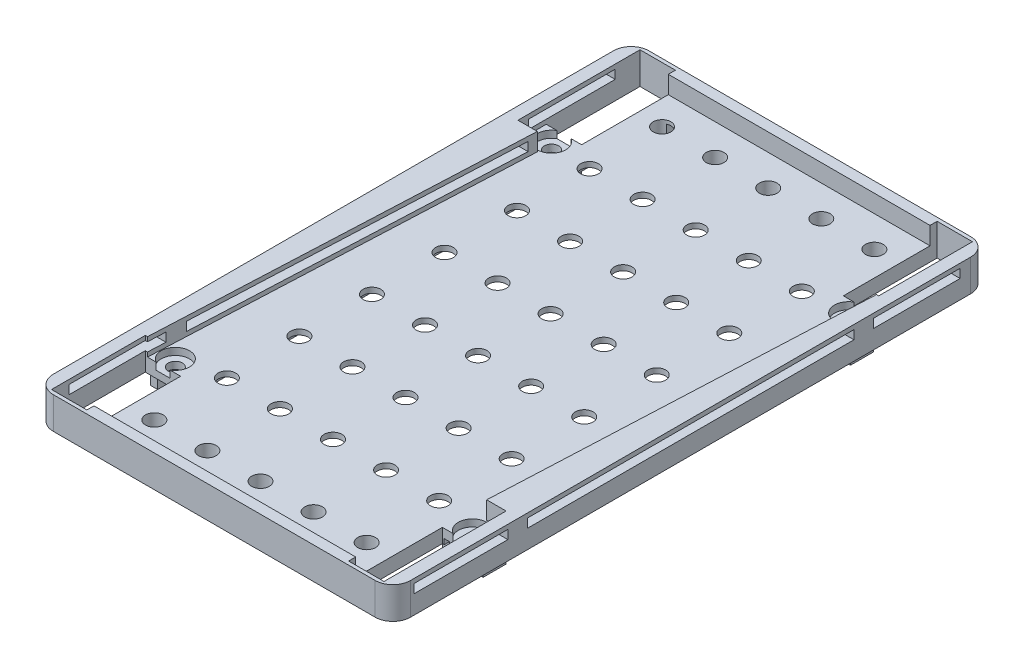
from build123d import *

# Parameters (mm, degrees)
SKETCH1_W                 = 100.974473103
SKETCH1_H                 = 168.325232528
BOSS_EXTRUDE1_DEPTH       = 5
SKETCH2_W                 = 100.974473103
SKETCH2_H                 = 168.325232528
BOSS_EXTRUDE2_DEPTH       = 4
SKETCH4_W                 = 2
SKETCH4_H                 = 6.5
BOSS_EXTRUDE3_DEPTH       = 4
SKETCH4_5_W               = 2
SKETCH4_5_H               = 25
SKETCH4_5_W_2             = 6
CUT_EXTRUDE3_DEPTH        = 124
SKETCH4_6_R               = 2
CUT_EXTRUDE4_DEPTH        = 124
CUT_EXTRUDE5_START        = -2
SKETCH6_R                 = 4
CUT_EXTRUDE5_DEPTH        = 21
SKETCH7_W                 = 10
SKETCH7_H                 = 1.5
CUT_EXTRUDE6_DEPTH        = 19
MIRROR3_COPY_1_SKETCH_W   = 2
MIRROR3_COPY_1_SKETCH_H   = 6.5
MIRROR3_COPY_1_DEPTH      = 4
MIRROR3_COPY_2_SKETCH_W   = 2
MIRROR3_COPY_2_SKETCH_H   = 25
MIRROR3_COPY_2_SKETCH_W_2 = 6
MIRROR3_COPY_2_DEPTH      = 124
MIRROR3_COPY_3_SKETCH_R   = 2
MIRROR3_COPY_3_DEPTH      = 124
MIRROR3_START             = -2
MIRROR3_COPY_4_SKETCH_R   = 4
MIRROR3_COPY_4_DEPTH      = 21
MIRROR3_COPY_5_SKETCH_W   = 10
MIRROR3_COPY_5_SKETCH_H   = 1.5
MIRROR3_COPY_5_DEPTH      = 19
SKETCH10_W                = 2
SKETCH10_H                = 6.5
BOSS_EXTRUDE4_DEPTH       = 4
MIRROR5_COPY_1_SKETCH_W   = 2
MIRROR5_COPY_1_SKETCH_H   = 6.5
MIRROR5_COPY_1_DEPTH      = 4
SKETCH8_W                 = 68.974473103
SKETCH8_H                 = 127.325232528
CUT_EXTRUDE7_DEPTH        = 2.5
FILLET1_R                 = 5
FILLET2_R                 = 5
FILLET3_R                 = 5
FILLET4_R                 = 5
SKETCH12_W                = 50.974473103
SKETCH12_H                = 2
BOSS_EXTRUDE6_DEPTH       = 17.5
SKETCH13_W                = 50.974473103
SKETCH13_H                = 1.5
BOSS_EXTRUDE7_DEPTH       = 20
SKETCH14_W                = 5.504592277
SKETCH14_H                = 8
CUT_EXTRUDE11_DEPTH       = 5
SKETCH15_W                = 5.504592276
SKETCH15_H                = 8
CUT_EXTRUDE13_DEPTH       = 5
SKETCH16_W                = 1.5
SKETCH16_H                = 9.191255783
SKETCH16_H_2              = 8.623656915
SKETCH16_H_3              = 11.145550433
SKETCH16_H_4              = 13.525087137
CUT_EXTRUDE15_DEPTH       = 1.5
SKETCH17_W                = 3
SKETCH17_H                = 20.5
CUT_EXTRUDE16_DEPTH       = 3
SKETCH18_W                = 2.5
SKETCH18_H                = 20.682541109
SKETCH18_H_2              = 20
SKETCH18_W_2              = 14.974473103
CUT_EXTRUDE18_DEPTH       = 19
BOSS_EXTRUDE8_START       = -45.974473
BOSS_EXTRUDE8_DEPTH       = 45.974473
SKETCH20_W                = 14.974473103
SKETCH20_H                = 5.765862106
CUT_EXTRUDE19_DEPTH       = 19
SKETCH21_W                = 92.325232528
SKETCH21_H                = 2.5
CUT_EXTRUDE21_DEPTH       = 151
SKETCH22_R                = 2.5
CUT_EXTRUDE22_DEPTH       = 151
LPATTERN1_COUNT           = 8
LPATTERN1_PITCH           = 20.5
BOSS_EXTRUDE9_DEPTH       = 5
BOSS_EXTRUDE10_DEPTH      = 6.5
BOSS_EXTRUDE11_DEPTH      = 6.5
SKETCH28_W                = 26.5
SKETCH28_H                = 2.5
SKETCH28_W_2              = 24.5
CUT_EXTRUDE23_DEPTH       = 124
SKETCH29_W                = 88.620615797
SKETCH29_H                = 24.04223464
CUT_EXTRUDE24_DEPTH       = 60


with BuildPart() as part:
    # Sketch1 → Boss-Extrude1 (new body)
    with BuildSketch(Plane(origin=(0, 0, 0), x_dir=(1, 0, 0), z_dir=(0, 1, 0))):
        with Locations((1.308903663, 1.25)):
            Rectangle(SKETCH1_W, SKETCH1_H)
        Polygon((-38.701208987, 82.412616264), (48.796140214, 82.412616264), (41.319016312, -79.912616264), (-46.178332889, -79.912616264), align=None, mode=Mode.SUBTRACT)
    extrude(amount=BOSS_EXTRUDE1_DEPTH)

    # Sketch2 → Boss-Extrude2 (add)
    with BuildSketch(Plane.XZ):
        with Locations((1.308903663, -1.25)):
            Rectangle(SKETCH2_W, SKETCH2_H)
    extrude(amount=BOSS_EXTRUDE2_DEPTH)

    # Sketch4 → Boss-Extrude3 (add)
    with BuildSketch(Plane.XZ.offset(4)):
        with Locations((47.296140214, -53.162616264)):
            Rectangle(SKETCH4_W, SKETCH4_H)
    boss_extrude3 = extrude(amount=BOSS_EXTRUDE3_DEPTH)

    # Sketch4<5> → Cut-Extrude3 (cut)
    with BuildSketch(Plane.XZ.offset(4)):
        with Locations((47.296140214, -70.412616264)):
            Rectangle(SKETCH4_5_W, SKETCH4_5_H)
        with Locations((43.296140214, -70.412616264)):
            Rectangle(SKETCH4_5_W_2, SKETCH4_5_H)
        with Locations((39.296140214, -70.412616264)):
            Rectangle(SKETCH4_5_W, SKETCH4_5_H)
    cut_extrude3 = extrude(amount=-CUT_EXTRUDE3_DEPTH, mode=Mode.SUBTRACT)

    # Sketch4<6> → Cut-Extrude4 (cut)
    with BuildSketch(Plane.XZ.offset(4)):
        with Locations(Location((43.296140214, -54.412616264, 0), (0, 0, 270))):
            Circle(SKETCH4_6_R)
    cut_extrude4 = extrude(amount=-CUT_EXTRUDE4_DEPTH, mode=Mode.SUBTRACT)

    # Sketch6 → Cut-Extrude5 (cut)
    with BuildSketch(Plane(origin=(0, 0, 0), x_dir=(1, 0, 0), z_dir=(0, 1, 0)).offset(CUT_EXTRUDE5_START)):
        with Locations((43.296140214, 54.412616264)):
            Circle(SKETCH6_R)
    cut_extrude5 = extrude(amount=CUT_EXTRUDE5_DEPTH, mode=Mode.SUBTRACT)

    # Sketch7 → Cut-Extrude6 (cut)
    with BuildSketch(Plane.XZ.offset(4)):
        with Locations((43.296140214, -83.662616264)):
            Rectangle(SKETCH7_W, SKETCH7_H)
    cut_extrude6 = extrude(amount=-CUT_EXTRUDE6_DEPTH, mode=Mode.SUBTRACT)

    # Mirror2: Boss-Extrude3, Cut-Extrude3, Cut-Extrude4, Cut-Extrude5, Cut-Extrude6 across plane
    add(boss_extrude3.mirror(Plane(origin=(0, 0, -1.25), x_dir=(1, 0, 0), z_dir=(0, 0, -1))))
    add(cut_extrude3.mirror(Plane(origin=(0, 0, -1.25), x_dir=(1, 0, 0), z_dir=(0, 0, -1))), mode=Mode.SUBTRACT)
    add(cut_extrude4.mirror(Plane(origin=(0, 0, -1.25), x_dir=(1, 0, 0), z_dir=(0, 0, -1))), mode=Mode.SUBTRACT)
    add(cut_extrude5.mirror(Plane(origin=(0, 0, -1.25), x_dir=(1, 0, 0), z_dir=(0, 0, -1))), mode=Mode.SUBTRACT)
    add(cut_extrude6.mirror(Plane(origin=(0, 0, -1.25), x_dir=(1, 0, 0), z_dir=(0, 0, -1))), mode=Mode.SUBTRACT)

    # Mirror3: Boss-Extrude3, Cut-Extrude3, Cut-Extrude4, Cut-Extrude5, Cut-Extrude6 across plane
    add(boss_extrude3.mirror(Plane.ZY.offset(-1.308903663)))
    add(cut_extrude3.mirror(Plane.ZY.offset(-1.308903663)), mode=Mode.SUBTRACT)
    add(cut_extrude4.mirror(Plane.ZY.offset(-1.308903663)), mode=Mode.SUBTRACT)
    add(cut_extrude5.mirror(Plane.ZY.offset(-1.308903663)), mode=Mode.SUBTRACT)
    add(cut_extrude6.mirror(Plane.ZY.offset(-1.308903663)), mode=Mode.SUBTRACT)

    # Mirror3 copy 1 sketch → Mirror3 copy 1 (add)
    with BuildSketch(Plane(origin=(2.617807325, -4, -2.5), x_dir=(-1, 0, 0), z_dir=(0, -1, 0))):
        with Locations((47.296140214, -53.162616264)):
            Rectangle(MIRROR3_COPY_1_SKETCH_W, MIRROR3_COPY_1_SKETCH_H)
    extrude(amount=MIRROR3_COPY_1_DEPTH)

    # Mirror3 copy 2 sketch → Mirror3 copy 2 (cut)
    with BuildSketch(Plane(origin=(2.617807325, -4, -2.5), x_dir=(-1, 0, 0), z_dir=(0, -1, 0))):
        with Locations((47.296140214, -70.412616264)):
            Rectangle(MIRROR3_COPY_2_SKETCH_W, MIRROR3_COPY_2_SKETCH_H)
        with Locations((43.296140214, -70.412616264)):
            Rectangle(MIRROR3_COPY_2_SKETCH_W_2, MIRROR3_COPY_2_SKETCH_H)
        with Locations((39.296140214, -70.412616264)):
            Rectangle(MIRROR3_COPY_2_SKETCH_W, MIRROR3_COPY_2_SKETCH_H)
    extrude(amount=-MIRROR3_COPY_2_DEPTH, mode=Mode.SUBTRACT)

    # Mirror3 copy 3 sketch → Mirror3 copy 3 (cut)
    with BuildSketch(Plane(origin=(2.617807325, -4, -2.5), x_dir=(-1, 0, 0), z_dir=(0, -1, 0))):
        with Locations(Location((43.296140214, -54.412616264, 0), (0, 0, 270))):
            Circle(MIRROR3_COPY_3_SKETCH_R)
    extrude(amount=-MIRROR3_COPY_3_DEPTH, mode=Mode.SUBTRACT)

    # Mirror3 copy 4 sketch → Mirror3 copy 4 (cut)
    with BuildSketch(Plane(origin=(2.617807325, 0, -2.5), x_dir=(-1, 0, 0), z_dir=(0, 1, 0)).offset(MIRROR3_START)):
        with Locations((43.296140214, 54.412616264)):
            Circle(MIRROR3_COPY_4_SKETCH_R)
    extrude(amount=MIRROR3_COPY_4_DEPTH, mode=Mode.SUBTRACT)

    # Mirror3 copy 5 sketch → Mirror3 copy 5 (cut)
    with BuildSketch(Plane(origin=(2.617807325, -4, -2.5), x_dir=(-1, 0, 0), z_dir=(0, -1, 0))):
        with Locations((43.296140214, -83.662616264)):
            Rectangle(MIRROR3_COPY_5_SKETCH_W, MIRROR3_COPY_5_SKETCH_H)
    extrude(amount=-MIRROR3_COPY_5_DEPTH, mode=Mode.SUBTRACT)

    # Sketch10 → Boss-Extrude4 (add)
    with BuildSketch(Plane.XZ.offset(4)):
        with Locations((37.796140214, -53.162616264)):
            Rectangle(SKETCH10_W, SKETCH10_H)
    boss_extrude4 = extrude(amount=BOSS_EXTRUDE4_DEPTH)

    # Mirror4: Boss-Extrude4 across plane
    add(boss_extrude4.mirror(Plane.ZY.offset(-1.308903663)))

    # Mirror5: Boss-Extrude4 across plane
    add(boss_extrude4.mirror(Plane(origin=(0, 0, -1.25), x_dir=(1, 0, 0), z_dir=(0, 0, -1))))

    # Mirror5 copy 1 sketch → Mirror5 copy 1 (add)
    with BuildSketch(Plane(origin=(2.617807325, -4, -2.5), x_dir=(-1, 0, 0), z_dir=(0, -1, 0))):
        with Locations((37.796140214, -53.162616264)):
            Rectangle(MIRROR5_COPY_1_SKETCH_W, MIRROR5_COPY_1_SKETCH_H)
    extrude(amount=MIRROR5_COPY_1_DEPTH)

    # Sketch8 → Cut-Extrude7 (cut)
    with BuildSketch(Plane.XZ.offset(4)):
        with Locations((1.308903663, -1.25)):
            Rectangle(SKETCH8_W, SKETCH8_H)
    extrude(amount=-CUT_EXTRUDE7_DEPTH, mode=Mode.SUBTRACT)

    # Fillet1
    fillet1_edges = [part.edges().sort_by_distance(p)[0] for p in [
        (51.796140214, 0.5, -85.412616264),
    ]]
    fillet(fillet1_edges, radius=FILLET1_R)

    # Fillet2
    fillet2_edges = [part.edges().sort_by_distance(p)[0] for p in [
        (-49.178332889, 0.5, -85.412616264),
    ]]
    fillet(fillet2_edges, radius=FILLET2_R)

    # Fillet3
    fillet3_edges = [part.edges().sort_by_distance(p)[0] for p in [
        (51.796140214, 0.5, 82.912616264),
    ]]
    fillet(fillet3_edges, radius=FILLET3_R)

    # Fillet4
    fillet4_edges = [part.edges().sort_by_distance(p)[0] for p in [
        (-49.178332889, 0.5, 82.912616264),
    ]]
    fillet(fillet4_edges, radius=FILLET4_R)

    # Sketch12 → Boss-Extrude6 (add)
    with BuildSketch(Plane(origin=(0, 0, -85.412616264), x_dir=(-1, 0, 0), z_dir=(0, 0, -1))):
        with Locations((-1.308903663, -3)):
            Rectangle(SKETCH12_W, SKETCH12_H)
    extrude(amount=BOSS_EXTRUDE6_DEPTH)

    # Sketch13 → Boss-Extrude7 (add)
    with BuildSketch(Plane.XZ.offset(4)):
        with Locations((1.308903663, -103.662616264)):
            Rectangle(SKETCH13_W, SKETCH13_H)
    extrude(amount=-BOSS_EXTRUDE7_DEPTH)

    # Sketch14 → Cut-Extrude11 (cut)
    with BuildSketch(Plane(origin=(0, 5, 0), x_dir=(1, 0, 0), z_dir=(0, 1, 0))):
        with Locations((-42.926036751, 53.912616264)):
            Rectangle(SKETCH14_W, SKETCH14_H)
    extrude(amount=-CUT_EXTRUDE11_DEPTH, mode=Mode.SUBTRACT)

    # Sketch15 → Cut-Extrude13 (cut)
    with BuildSketch(Plane(origin=(0, 5, 0), x_dir=(1, 0, 0), z_dir=(0, 1, 0))):
        with Locations((45.543844076, -51.412616264)):
            Rectangle(SKETCH15_W, SKETCH15_H)
    extrude(amount=-CUT_EXTRUDE13_DEPTH, mode=Mode.SUBTRACT)

    # Sketch16 → Cut-Extrude15 (cut)
    with BuildSketch(Plane.XZ.offset(4)):
        with Locations((-36.928332889, 52.008244156)):
            Rectangle(SKETCH16_W, SKETCH16_H)
        with Locations((39.546140214, 51.724444722)):
            Rectangle(SKETCH16_W, SKETCH16_H_2)
        with Locations((-36.928332889, -55.48539148)):
            Rectangle(SKETCH16_W, SKETCH16_H_3)
        with Locations((39.546140214, -56.675159833)):
            Rectangle(SKETCH16_W, SKETCH16_H_4)
    extrude(amount=-CUT_EXTRUDE15_DEPTH, mode=Mode.SUBTRACT)

    # Sketch17 → Cut-Extrude16 (cut)
    with BuildSketch(Plane.XZ.offset(4)):
        with Locations((-28.178332889, -75.162616264)):
            Rectangle(SKETCH17_W, SKETCH17_H)
    extrude(amount=-CUT_EXTRUDE16_DEPTH, mode=Mode.SUBTRACT)

    # Sketch18 → Cut-Extrude18 (cut)
    with BuildSketch(Plane(origin=(0, 0, -104.412616264), x_dir=(-1, 0, 0), z_dir=(0, 0, -1))):
        with Locations((-25.546140214, 5.658729445)):
            Rectangle(SKETCH18_W, SKETCH18_H)
        with Locations((22.928332889, 6)):
            Rectangle(SKETCH18_W, SKETCH18_H_2)
        with Locations((-1.308903663, 6)):
            Rectangle(SKETCH18_W_2, SKETCH18_H_2)
    extrude(amount=-CUT_EXTRUDE18_DEPTH, mode=Mode.SUBTRACT)

    # Sketch19 → Boss-Extrude8 (add)
    with BuildSketch(Plane.ZY.offset(21.678332889).offset(BOSS_EXTRUDE8_START)):
        Polygon((-86.412616264, -2), (-85.412616264, -2), (-85.412616264, -1), align=None)
        Polygon((-102.912616264, -2), (-101.912616264, -2), (-102.912616264, -1), align=None)
    extrude(amount=BOSS_EXTRUDE8_DEPTH)

    # Sketch20 → Cut-Extrude19 (cut)
    with BuildSketch(Plane(origin=(0, 0, -104.412616264), x_dir=(-1, 0, 0), z_dir=(0, 0, -1))):
        with Locations((-1.308903663, -1.117068947)):
            Rectangle(SKETCH20_W, SKETCH20_H)
    extrude(amount=-CUT_EXTRUDE19_DEPTH, mode=Mode.SUBTRACT)

    # Sketch21 → Cut-Extrude21 (cut)
    with BuildSketch(Plane(origin=(51.796140214, 0, 0), x_dir=(0, 0, -1), z_dir=(1, 0, 0))):
        with Locations((1.25, 2.5)):
            Rectangle(SKETCH21_W, SKETCH21_H)
    extrude(amount=-CUT_EXTRUDE21_DEPTH, mode=Mode.SUBTRACT)

    # Sketch22 → Cut-Extrude22 (cut)
    with BuildSketch(Plane(origin=(0, 0, 0), x_dir=(1, 0, 0), z_dir=(0, 1, 0))):
        with Locations(Location((1.308903663, 73.662616264, 0), (0, 0, 270))):
            Circle(SKETCH22_R)
        with Locations(Location((16.308903663, 73.662616264, 0), (0, 0, 270))):
            Circle(SKETCH22_R)
        with Locations(Location((31.308903663, 73.662616264, 0), (0, 0, 270))):
            Circle(SKETCH22_R)
        with Locations(Location((-28.691096337, 73.662616264, 0), (0, 0, 246.740598029))):
            Circle(SKETCH22_R)
        with Locations(Location((-13.691096337, 73.662616264, 0), (0, 0, 90))):
            Circle(SKETCH22_R)
    cut_extrude22 = extrude(amount=-CUT_EXTRUDE22_DEPTH, mode=Mode.SUBTRACT)

    # LPattern1: Cut-Extrude22 ×8
    with Locations(*[(0, 0, i * LPATTERN1_PITCH) for i in range(1, LPATTERN1_COUNT)]):
        add(cut_extrude22, mode=Mode.SUBTRACT)

    # Sketch23 → Boss-Extrude9 (add)
    with BuildSketch(Plane(origin=(0, 0, 0), x_dir=(1, 0, 0), z_dir=(0, 1, 0))):
        Polygon((-46.178332889, -79.912616264), (-45.678332889, -79.912616264), (-45.678332889, -69.057825394), align=None)
        Polygon((48.296140214, 82.412616264), (48.796140214, 82.412616264), (48.296140214, 71.557825394), align=None)
    extrude(amount=BOSS_EXTRUDE9_DEPTH)

    # Sketch24 → Boss-Extrude10 (add)
    with BuildSketch(Plane.XY.offset(53.912616264)):
        Polygon((-34.178332889, -4), (-33.178332889, -4), (-34.178332889, -5), align=None)
        Polygon((-46.678332889, -4), (-45.678332889, -5), (-45.678332889, -4), align=None)
    boss_extrude10 = extrude(amount=-BOSS_EXTRUDE10_DEPTH)

    # Mirror7: Boss-Extrude10 across plane
    add(boss_extrude10.mirror(Plane.ZY.offset(-1.308903663)))

    # Sketch27 → Boss-Extrude11 (add)
    with BuildSketch(Plane(origin=(0, 0, -56.412616264), x_dir=(-1, 0, 0), z_dir=(0, 0, -1))):
        Polygon((45.678332889, -5), (45.678332889, -4), (46.678332889, -4), align=None)
        Polygon((33.178332889, -4), (34.178332889, -4), (34.178332889, -5), align=None)
        Polygon((-36.796140214, -5), (-36.796140214, -4), (-35.796140214, -4), align=None)
        Polygon((-49.296140214, -4), (-48.296140214, -5), (-48.296140214, -4), align=None)
    extrude(amount=-BOSS_EXTRUDE11_DEPTH)

    # Sketch28 → Cut-Extrude23 (cut)
    with BuildSketch(Plane.ZY.offset(49.178332889)):
        with Locations((63.662616264, 2.5)):
            Rectangle(SKETCH28_W, SKETCH28_H)
        with Locations((-65.162616264, 2.5)):
            Rectangle(SKETCH28_W_2, SKETCH28_H)
    extrude(amount=-CUT_EXTRUDE23_DEPTH, mode=Mode.SUBTRACT)

    # Sketch29 → Cut-Extrude24 (cut)
    with BuildSketch(Plane.XZ.offset(4)):
        with Locations((0.835204273, -97.433733584)):
            Rectangle(SKETCH29_W, SKETCH29_H)
    extrude(amount=-CUT_EXTRUDE24_DEPTH, mode=Mode.SUBTRACT)


solid = part.part
